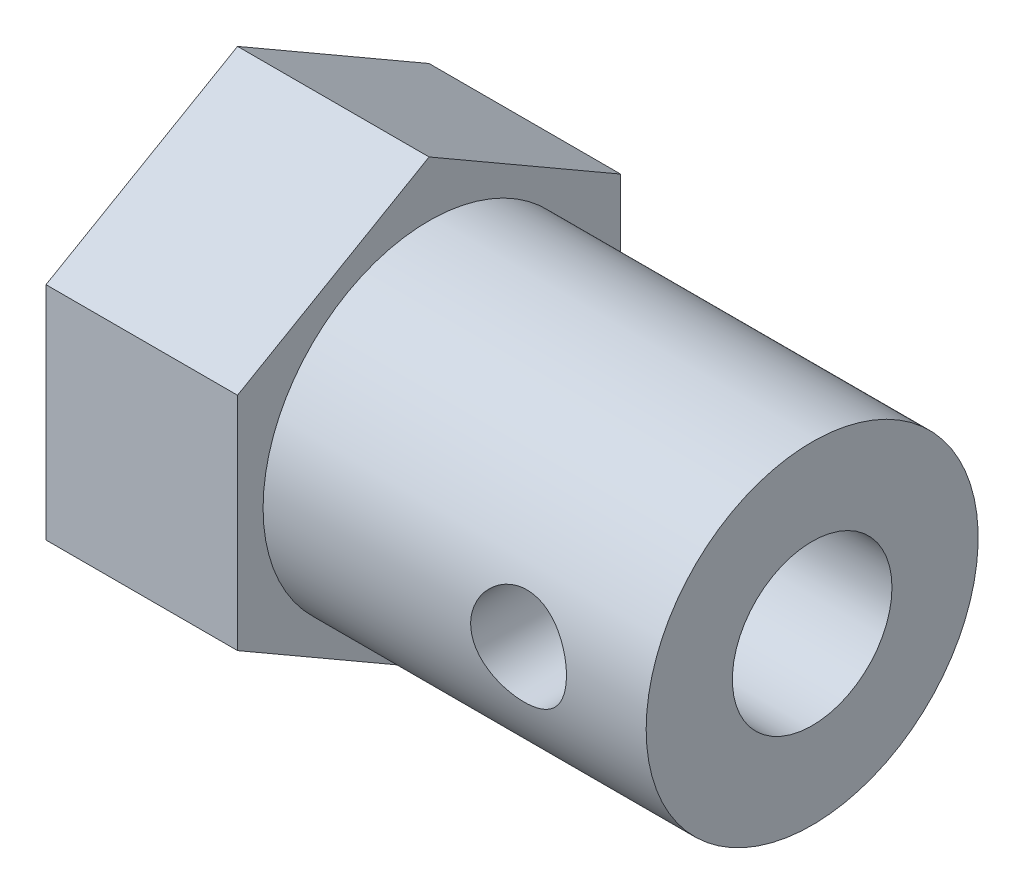
from build123d import *

# Parameters (mm, degrees)
EXTRUDE_1_DEPTH                = 6
SKETCH_2_W                     = 12
SKETCH_2_H                     = 5.2
HOLE_WIZARD_M3_5_1_D           = 4
HOLE_WIZARD_M3_5_1_CBORE_D     = 5
HOLE_WIZARD_M3_5_1_CBORE_DEPTH = 12
SKETCH_5_W                     = 1.5
SKETCH_5_H                     = 4.122312264


with BuildPart() as part:
    # 草图1 → 凸台-拉伸1 (new body)
    with BuildSketch(Plane(origin=(-88, 0, 0), x_dir=(0, -1, 0), z_dir=(-1, 0, 0))):
        Polygon((76.92820323, -33.5), (73.464101615, -27.5), (66.535898385, -27.5), (63.07179677, -33.5), (66.535898385, -39.5), (73.464101615, -39.5), align=None)
    extrude(amount=-EXTRUDE_1_DEPTH)

    # 草图2 → 旋转1 (revolve)
    with BuildSketch(Plane(origin=(0, 0, -33.5), x_dir=(-1, 0, 0), z_dir=(0, 0, -1)), mode=Mode.PRIVATE) as revolve_1_sk:
        with Locations((76, -67.4)):
            Rectangle(SKETCH_2_W, SKETCH_2_H)
    revolve(revolve_1_sk.sketch.rotate(Axis((-70, -70, -33.5), (-1, 0, 0)), 270), axis=Axis((-70, -70, -33.5), (-1, 0, 0)))

    # M3.5 六角头机械螺钉的柱形沉头孔1 (through all)
    with Locations(Plane(origin=(-70, 0, 0), x_dir=(0, 0, -1), z_dir=(1, 0, 0))):
        with Locations((33.5, -70)):
            CounterBoreHole(HOLE_WIZARD_M3_5_1_D / 2, HOLE_WIZARD_M3_5_1_CBORE_D / 2, HOLE_WIZARD_M3_5_1_CBORE_DEPTH)

    # 草图5 → Ø3.0 (3) 直径孔1 (revolve, cut)
    with BuildSketch(Plane(origin=(-74, -69.849458039, -31.622312264), x_dir=(0, 1, 0), z_dir=(1, 0, 0))):
        with Locations((0.75, 2.061156132)):
            Rectangle(SKETCH_5_W, SKETCH_5_H)
    revolve(axis=Axis((-74, -69.849458039, -37.972312264), (0, 0, 1)), mode=Mode.SUBTRACT)


solid = part.part
